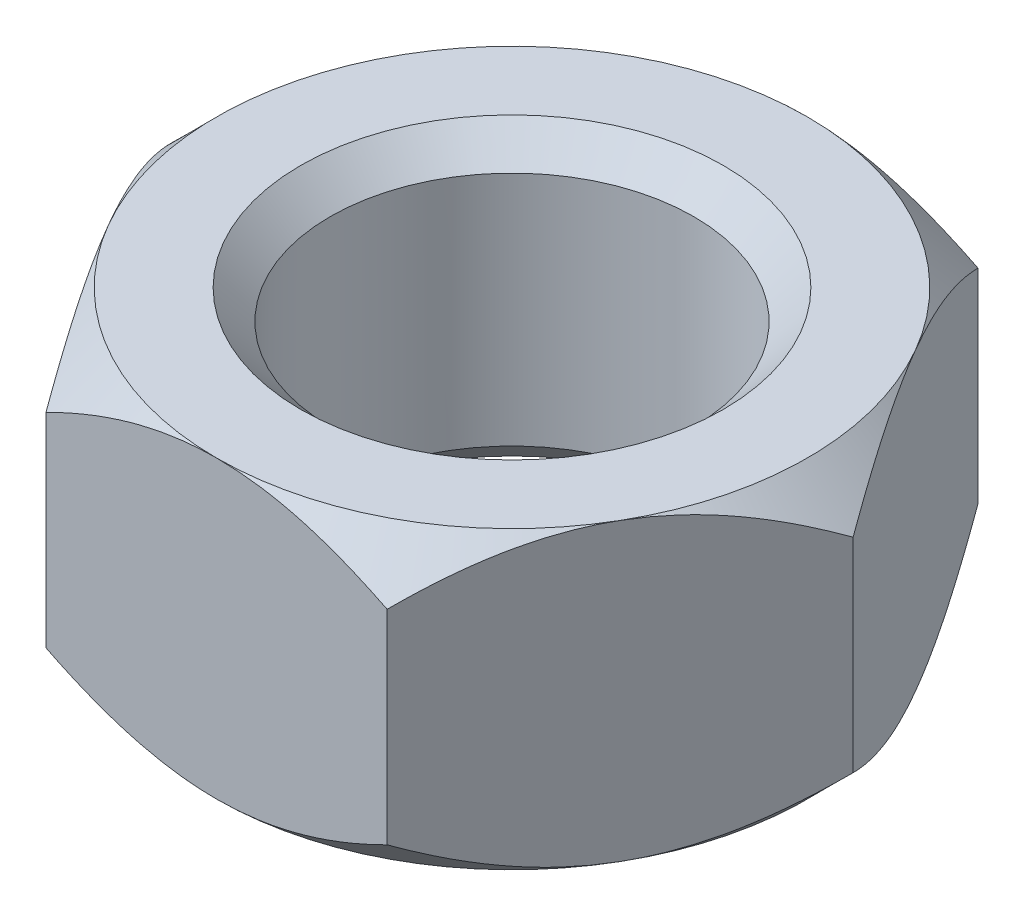
from build123d import *

# Parameters (mm, degrees)
SKETCH1_R           = 4
BOSS_EXTRUDE1_DEPTH = 6.5
CHAMFER1_SIZE       = 0.65


with BuildPart() as part:
    # Sketch1 → Boss-Extrude1 (new body)
    with BuildSketch(Plane(origin=(0, 0, 0), x_dir=(1, 0, 0), z_dir=(0, 1, 0))):
        Polygon((7.505553499, 0), (3.75277675, 6.5), (-3.75277675, 6.5), (-7.505553499, 0), (-3.75277675, -6.5), (3.75277675, -6.5), align=None)
        with Locations(Location((0, 0, 0), (0, 0, 90))):
            Circle(SKETCH1_R, mode=Mode.SUBTRACT)
    extrude(amount=BOSS_EXTRUDE1_DEPTH)

    # Sketch3 → Cut-Revolve1 (revolve, cut)
    with BuildSketch(Plane(origin=(0, 0, 0), x_dir=(0, 0, -1), z_dir=(1, 0, 0))):
        Polygon((-6.5, 0), (-8.75, 2.25), (-8.75, 0), align=None)
        Polygon((-8.75, 6.5), (-6.5, 6.5), (-8.75, 4.25), align=None)
    revolve(axis=Axis((0, 0, 0), (0, 1, 0)), mode=Mode.SUBTRACT)

    # Chamfer1
    chamfer1_edges = [part.edges().sort_by_distance(p)[0] for p in [
        (0, 0, 4),
        (0, 6.5, 4),
    ]]
    chamfer(chamfer1_edges, length=CHAMFER1_SIZE)


solid = part.part
